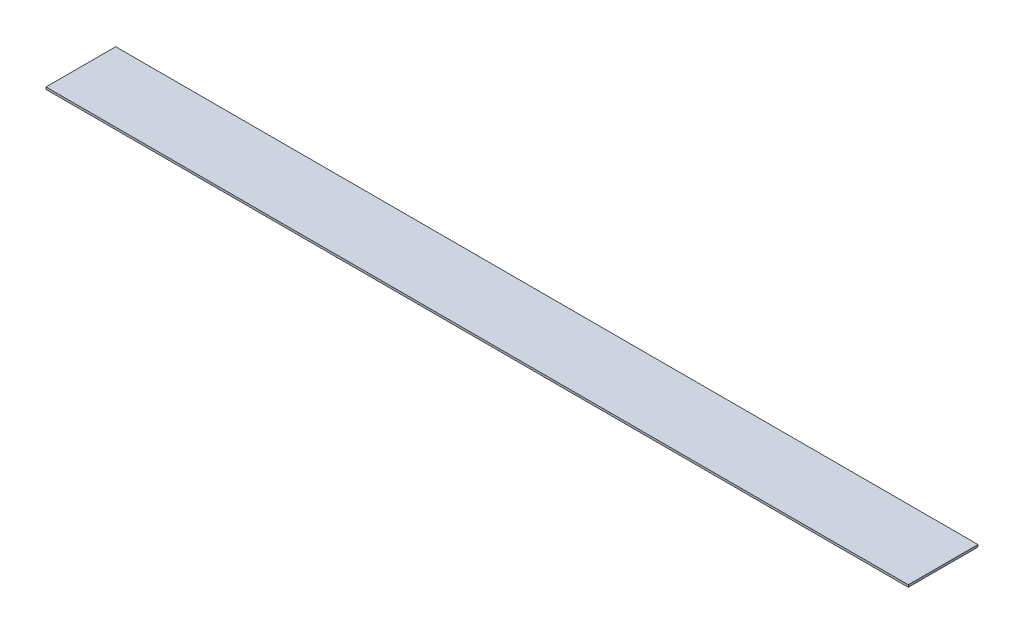
from build123d import *

# Parameters (mm, degrees)
SKETCH1_W           = 558.8
SKETCH1_H           = 50.8
BOSS_EXTRUDE1_DEPTH = 1.5875
SKETCH2_W           = 50.8
SKETCH2_H           = 1.5875
BOSS_EXTRUDE2_DEPTH = 69.85


with BuildPart() as part:
    # Sketch1 → Boss-Extrude1 (new body)
    with BuildSketch(Plane(origin=(0, 0, 0), x_dir=(1, 0, 0), z_dir=(0, 1, 0))):
        with Locations((279.4, 25.4)):
            Rectangle(SKETCH1_W, SKETCH1_H)
    extrude(amount=BOSS_EXTRUDE1_DEPTH)

    # Sketch2 → Boss-Extrude2 (add)
    with BuildSketch(Plane(origin=(558.8, 0, 0), x_dir=(0, 0, -1), z_dir=(1, 0, 0))):
        with Locations((25.4, 0.79375)):
            Rectangle(SKETCH2_W, SKETCH2_H)
    extrude(amount=BOSS_EXTRUDE2_DEPTH)


solid = part.part
